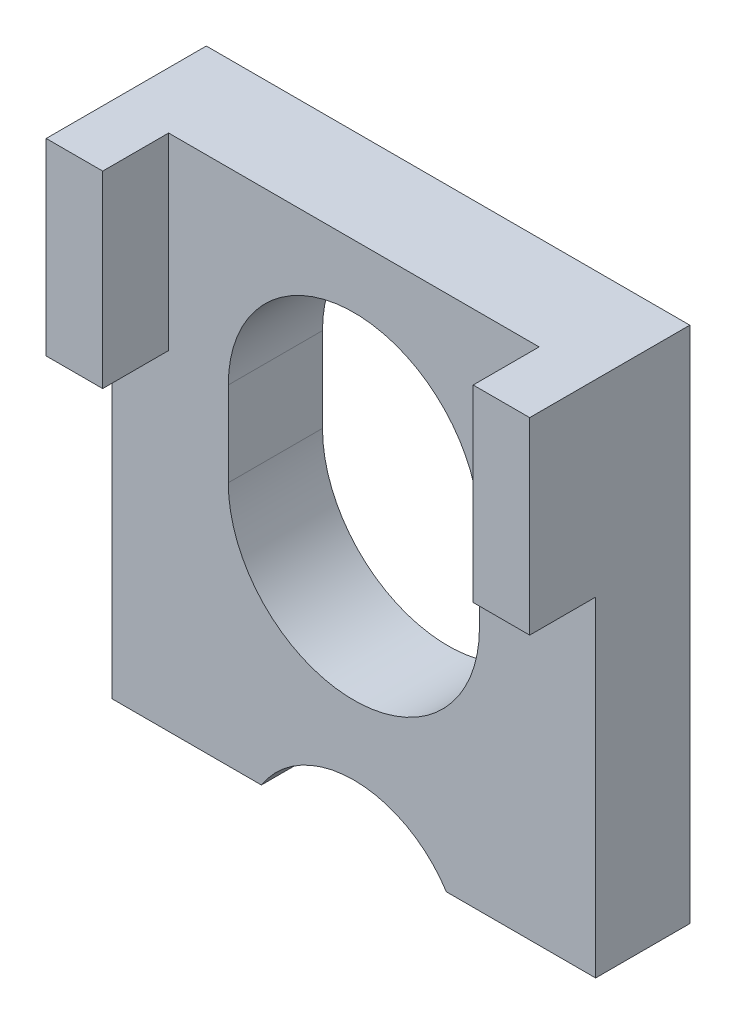
from build123d import *

# Parameters (mm, degrees)
EXTRUDE_1_DEPTH = 3
SKETCH_2_W      = 1.8
SKETCH_2_H      = 6
EXTRUDE_2_DEPTH = 2.1


with BuildPart() as part:
    # Эскиз1 → Бобышка-Вытянуть1 (new body)
    with BuildSketch(Plane.XY):
        with BuildLine():
            Line((-7.7, 13.737499607), (7.7, 13.737499607))
            Line((7.7, 13.737499607), (7.7, -0.039604792))
            Line((7.7, -0.039604792), (7.7, -2.769566851))
            Line((7.7, -2.769566851), (2.946206382, -2.769566851))
            ThreePointArc((2.946206382, -2.769566851), (0, -1.158976271), (-2.946206382, -2.769566851))
            Line((-2.946206382, -2.769566851), (-7.7, -2.769566851))
            Line((-7.7, -2.769566851), (-7.7, -0.039604792))
            Line((-7.7, -0.039604792), (-7.7, 13.737499607))
        make_face()
        with BuildLine():
            Line((4, 7.737499607), (4, 5.041023729))
            ThreePointArc((4, 5.041023729), (0, 1.041023729), (-4, 5.041023729))
            Line((-4, 5.041023729), (-4, 7.737499607))
            ThreePointArc((-4, 7.737499607), (0, 11.737499607), (4, 7.737499607))
        make_face(mode=Mode.SUBTRACT)
    extrude(amount=EXTRUDE_1_DEPTH)

    # Эскиз2 → Бобышка-Вытянуть2 (add)
    with BuildSketch(Plane.XY.offset(3)):
        with Locations((-6.8, 10.737499607)):
            Rectangle(SKETCH_2_W, SKETCH_2_H)
        with Locations((6.8, 10.737499607)):
            Rectangle(SKETCH_2_W, SKETCH_2_H)
    extrude(amount=EXTRUDE_2_DEPTH)


solid = part.part
